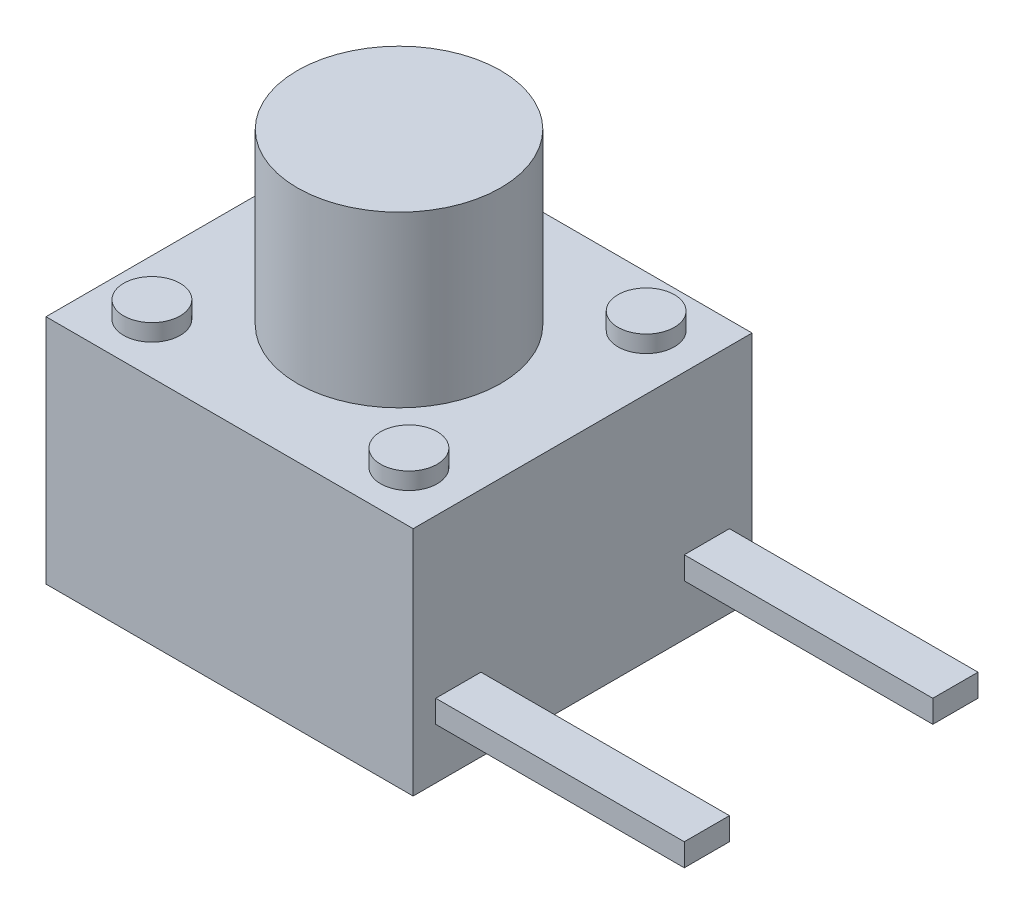
from build123d import *

# Parameters (mm, degrees)
SKETCH_1_W      = 6.5
SKETCH_1_H      = 6
EXTRUDE_1_DEPTH = 4.1
SKETCH_1_3_R    = 1.8
EXTRUDE_2_DEPTH = 7.1
EXTRUDE_START   = 4.1
SKETCH_1_4_R    = 0.5
EXTRUDE_3_DEPTH = 0.3
SKETCH_2_W      = 0.8
SKETCH_2_H      = 0.4
EXTRUDE_4_DEPTH = 4.4


with BuildPart() as part:
    # 草图1 → 凸台-拉伸1 (new body)
    with BuildSketch(Plane(origin=(0, 0, 0), x_dir=(1, 0, 0), z_dir=(0, 1, 0))):
        Rectangle(SKETCH_1_W, SKETCH_1_H)
    extrude(amount=EXTRUDE_1_DEPTH)

    # 草图1<3> → 凸台-拉伸2 (add)
    with BuildSketch(Plane(origin=(0, 0, 0), x_dir=(1, 0, 0), z_dir=(0, 1, 0))):
        with Locations(Location((0, 0, 0), (0, 0, 90))):
            Circle(SKETCH_1_3_R)
    extrude(amount=EXTRUDE_2_DEPTH)

    # 草图1<4> → 凸台-拉伸3 (add)
    with BuildSketch(Plane(origin=(0, 0, 0), x_dir=(1, 0, 0), z_dir=(0, 1, 0)).offset(EXTRUDE_START)):
        with Locations(Location((-2.275, 2.1, 0), (0, 0, 90))):
            Circle(SKETCH_1_4_R)
        with Locations(Location((-2.275, -2.1, 0), (0, 0, 90))):
            Circle(SKETCH_1_4_R)
        with Locations(Location((2.275, -2.1, 0), (0, 0, 90))):
            Circle(SKETCH_1_4_R)
        with Locations(Location((2.275, 2.1, 0), (0, 0, 90))):
            Circle(SKETCH_1_4_R)
    extrude(amount=EXTRUDE_3_DEPTH)

    # 草图2 → 凸台-拉伸4 (add)
    with BuildSketch(Plane(origin=(3.25, 0, 0), x_dir=(0, 0, -1), z_dir=(1, 0, 0))):
        with Locations((-2.2, 1.1)):
            Rectangle(SKETCH_2_W, SKETCH_2_H)
        with Locations((2.2, 1.1)):
            Rectangle(SKETCH_2_W, SKETCH_2_H)
    extrude(amount=EXTRUDE_4_DEPTH)


solid = part.part
